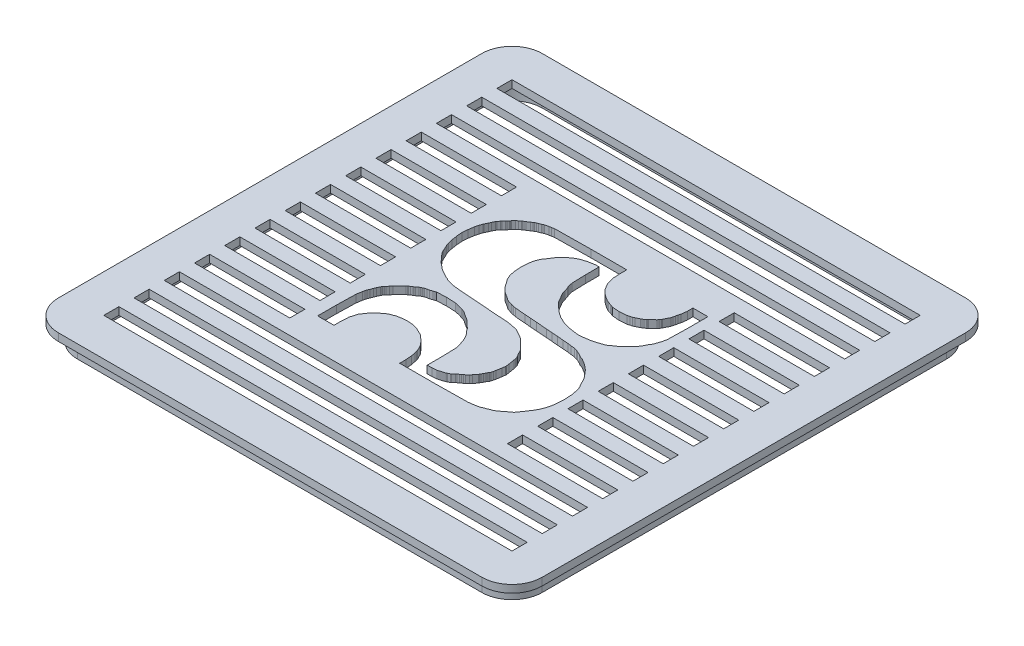
from build123d import *

# Parameters (mm, degrees)
ESQUISSE1_W             = 101.6
ESQUISSE1_H             = 101.6
BOSS_EXTRU_1_DEPTH      = 1.5875
CONG_1_R                = 6.35
BOSS_EXTRU_2_DEPTH      = 3.175
ENL_V_MAT_EXTRU_3_DEPTH = 3.175
ESQUISSE14_W            = 85.725
ESQUISSE14_H            = 3.175
ESQUISSE14_W_2          = 20.0025
ENL_V_MAT_EXTRU_5_DEPTH = 3.175


with BuildPart() as part:
    # Esquisse1 → Boss.-Extru.1 (new body)
    with BuildSketch(Plane(origin=(0, 0, 0), x_dir=(1, 0, 0), z_dir=(0, 1, 0))):
        Rectangle(ESQUISSE1_W, ESQUISSE1_H)
    extrude(amount=BOSS_EXTRU_1_DEPTH)

    # Congé1
    cong_1_edges = [part.edges().sort_by_distance(p)[0] for p in [
        (50.8, 0.79375, 50.8),
        (-50.8, 0.79375, 50.8),
        (-50.8, 0.79375, -50.8),
        (50.8, 0.79375, -50.8),
    ]]
    fillet(cong_1_edges, radius=CONG_1_R)

    # Esquisse2 → Boss.-Extru.2 (add)
    with BuildSketch(Plane.XZ):
        with BuildLine():
            Line((-42.465625, 48.815625), (42.465625, 48.815625))
            ThreePointArc((42.465625, 48.815625), (46.955753061, 46.955753061), (48.815625, 42.465625))
            Line((48.815625, 42.465625), (48.815625, -42.465625))
            ThreePointArc((48.815625, -42.465625), (46.955753061, -46.955753061), (42.465625, -48.815625))
            Line((42.465625, -48.815625), (-42.465625, -48.815625))
            ThreePointArc((-42.465625, -48.815625), (-46.955753061, -46.955753061), (-48.815625, -42.465625))
            Line((-48.815625, -42.465625), (-48.815625, 42.465625))
            ThreePointArc((-48.815625, 42.465625), (-46.955753061, 46.955753061), (-42.465625, 48.815625))
        make_face()
        with BuildLine():
            Line((-39.290625, 45.640625), (39.290625, 45.640625))
            ThreePointArc((39.290625, 45.640625), (43.780753061, 43.780753061), (45.640625, 39.290625))
            Line((45.640625, 39.290625), (45.640625, -39.290625))
            ThreePointArc((45.640625, -39.290625), (43.780753061, -43.780753061), (39.290625, -45.640625))
            Line((39.290625, -45.640625), (-39.290625, -45.640625))
            ThreePointArc((-39.290625, -45.640625), (-43.780753061, -43.780753061), (-45.640625, -39.290625))
            Line((-45.640625, -39.290625), (-45.640625, 39.290625))
            ThreePointArc((-45.640625, 39.290625), (-43.780753061, 43.780753061), (-39.290625, 45.640625))
        make_face(mode=Mode.SUBTRACT)
    extrude(amount=BOSS_EXTRU_2_DEPTH)

    # Esquisse12 → Enlèv. mat.-Extru.3 (cut)
    with BuildSketch(Plane(origin=(0, 1.5875, 0), x_dir=(1, 0, 0), z_dir=(0, 1, 0))):
        Polygon((-20.314766228, -16.53366558), (-20.219584808, -12.56369892), (-20.124403388, -11.94929832), (-20.029221968, -11.33489772), (-19.934040548, -10.95680856), (-19.838851508, -10.57871178), (-19.743670088, -10.38965958), (-19.648488668, -10.20060738), (-19.553307248, -9.9170367), (-19.458125828, -9.63346602), (-19.362944408, -9.3971622), (-19.267762988, -9.16085076), (-19.172581568, -8.97179856), (-19.077400148, -8.78274636), (-18.982218728, -8.59369416), (-18.887029688, -8.40464196), (-18.791848268, -8.26285662), (-18.649079948, -8.12107128), (-18.506304008, -7.97253462), (-18.173149988, -7.55392992), (-17.839995968, -7.13358024), (-16.461553208, -5.75799498), (-16.317017048, -5.66345364), (-16.195257068, -5.56893516), (-15.936276128, -5.37988296), (-15.629700668, -5.19083076), (-15.460346168, -5.0963199), (-15.310757948, -5.00180142), (-14.889219548, -4.63046358), (-14.698849088, -4.52919378), (-14.508486248, -4.4346753), (-14.318123408, -4.34016444), (-14.127760568, -4.24564596), (-13.699417508, -4.15112748), (-13.271082068, -4.05659376), (-12.985522568, -3.96207528), (-12.699963068, -3.8675568), (-12.414403568, -3.77304594), (-12.128844068, -3.6785046), (-10.177522088, -3.58398612), (-8.226200108, -3.6785046), (-7.750270148, -3.77304594), (-7.274332568, -3.8675568), (-6.988773068, -3.96207528), (-6.703213568, -4.05659376), (-6.370067168, -4.15112748), (-6.036913148, -4.24564596), (-5.846550308, -4.34016444), (-5.656179848, -4.4346753), (-5.465817008, -4.52919378), (-5.275454168, -4.67097912), (-5.106099668, -4.81276446), (-4.799524208, -5.00181666), (-4.492948748, -5.19086886), (-4.323594248, -5.28538734), (-4.180825928, -5.37992106), (-4.038049988, -5.47443954), (-3.893727188, -5.56895802), (-2.324685368, -7.05893472), (-2.134322528, -7.27037448), (-1.943952068, -7.57480872), (-1.794386708, -7.74298212), (-1.372848308, -8.18797488), (-1.182485468, -8.49916044), (-0.992115008, -8.8036023), (-0.896933588, -8.9717757), (-0.801752168, -9.1608279), (-0.706570748, -9.3498801), (-0.611389328, -9.58618392), (-0.516207908, -9.82249536), (-0.421026488, -10.10606604), (-0.325845068, -10.3896291), (-0.230656028, -10.67319978), (-0.135474608, -10.95677046), (-0.040293188, -11.33485962), (0.054888232, -11.7129564), (0.150069652, -14.83221864), (0.150115372, -17.95098558), (1.149554572, -17.95098558), (2.149009012, -17.8564671), (2.434568512, -17.76195624), (2.720128012, -17.66743776), (3.053282032, -17.57289642), (3.386436052, -17.47838556), (3.576798892, -17.38386708), (3.767161732, -17.28933336), (3.957524572, -17.19481488), (4.147895032, -17.1002964), (4.297460392, -17.00577792), (4.718998792, -16.58718084), (4.888353292, -16.43864418), (5.194928752, -16.24958436), (5.432893732, -16.06055502), (5.670866332, -15.87150282), (5.936644312, -15.68245062), (6.337166752, -15.30435384), (6.667844272, -14.92626468), (7.193845252, -14.26890252), (7.289026672, -14.07556788), (7.384208092, -13.90739448), (7.574578552, -13.60296024), (7.764941392, -13.2039999), (7.907717332, -12.94129278), (8.050485652, -12.75224058), (8.145667072, -12.56318838), (8.240848492, -12.13783236), (8.336037532, -11.71247634), (8.431218952, -11.1453426), (8.526400372, -10.57820124), (8.621581792, -9.86928216), (8.526400372, -9.16035546), (8.431218952, -8.54595486), (8.336037532, -7.93155426), (8.240848492, -7.5534651), (8.145667072, -7.17536832), (8.050485652, -6.9390645), (7.907717332, -6.70275306), (7.764941392, -6.51370086), (7.669759972, -6.32464866), (7.574578552, -6.13559646), (7.479397132, -5.94654426), (7.384208092, -5.75749206), (7.289026672, -5.56843986), (7.193845252, -5.42234922), (6.627054412, -4.8122463), (6.527529592, -4.71567042), (5.408372572, -3.5834451), (5.194913512, -3.3943929), (4.909354012, -3.20533308), (4.623794512, -3.01628088), (4.317219052, -2.82722868), (4.147864552, -2.73271782), (3.957501712, -2.63819934), (3.767138872, -2.543658), (3.576776032, -2.44914714), (3.386405572, -2.3073618), (3.053259172, -2.16557646), (2.720105152, -2.07105798), (2.339356612, -1.9765395), (1.958608072, -1.88202864), (1.387489072, -1.78751016), (0.816370072, -1.69299168), (-0.563832908, -1.59848082), (-1.944035888, -1.50396234), (-3.229057448, -1.40944386), (-4.514071388, -1.314933), (-5.799085328, -1.22041452), (-7.084106888, -1.12589604), (-8.369120828, -1.03137756), (-9.654142388, -0.93684384), (-10.606009928, -0.84232536), (-11.557877468, -0.7478145), (-11.938618388, -0.65327316), (-12.319366928, -0.55875468), (-12.700115468, -0.46424382), (-13.080856388, -0.36972534), (-13.271226848, -0.27520686), (-13.461589688, -0.13342152), (-13.794743708, 0.00836382), (-14.127897728, 0.15014154), (-14.318260568, 0.29192688), (-14.508623408, 0.38646822), (-14.698993868, 0.4809867), (-14.889379568, 0.57549756), (-15.058734068, 0.6700389), (-15.365301908, 0.8590911), (-15.650861408, 1.0481433), (-15.936420908, 1.2371955), (-16.155274928, 1.4262477), (-16.602728948, 1.80434448), (-17.077995968, 2.18243364), (-17.459407448, 2.6041854), (-18.217726988, 3.41123484), (-18.316070708, 3.5597715), (-18.690014588, 3.9783762), (-18.792015908, 4.1674284), (-18.887197328, 4.3564806), (-18.982378748, 4.5455328), (-19.077560168, 4.734585), (-19.172741588, 4.97089644), (-19.267923008, 5.20720026), (-19.363104428, 5.39625246), (-19.458285848, 5.58530466), (-19.553467268, 5.77435686), (-19.648656308, 5.96340906), (-19.743837728, 6.24698736), (-19.839019148, 6.53055042), (-19.934200568, 6.95590644), (-20.029381988, 7.38126246), (-20.124563408, 7.99566306), (-20.219744828, 8.61006366), (-20.314926248, 9.79160562), (-20.219744828, 10.97314758), (-20.124563408, 11.58754818), (-20.029381988, 12.20194878), (-19.934200568, 12.58003794), (-19.839019148, 12.9581271), (-19.743837728, 13.24169778), (-19.648656308, 13.52526846), (-19.553467268, 13.71431304), (-19.458285848, 13.90335762), (-19.363104428, 14.09240982), (-19.267923008, 14.2814544), (-19.172741588, 14.51775822), (-19.077560168, 14.75406966), (-18.982378748, 14.94311424), (-18.887197328, 15.13215882), (-18.792015908, 15.32121102), (-18.690014588, 15.5102556), (-18.316070708, 15.9288603), (-18.214092248, 16.07739696), (-17.840140748, 16.42787124), (-17.649777908, 16.6445307), (-17.459415068, 16.9017057), (-17.364226028, 17.02261986), (-17.269044608, 17.17115652), (-16.885697648, 17.58976122), (-16.507555148, 17.87332428), (-16.136217308, 18.15689496), (-16.031632808, 18.25140582), (-15.862278308, 18.34591668), (-15.555702848, 18.53496888), (-15.270150968, 18.72401346), (-14.984591468, 18.91305804), (-14.678016008, 19.10210262), (-14.508661508, 19.24388796), (-14.223102008, 19.3856733), (-13.937542508, 19.48018416), (-13.699577528, 19.57469502), (-13.461612548, 19.66920588), (-13.271249708, 19.76372436), (-13.080879248, 19.85823522), (-12.700138328, 19.95274608), (-12.319389788, 20.04725694), (-11.795865308, 20.14177542), (-11.272340828, 20.23630152), (-3.752612408, 20.33082), (3.767176972, 20.33037042), (3.767176972, 18.77055642), (3.862358392, 17.2109253), (3.957539812, 16.88009538), (4.052721232, 16.54926546), (4.147902652, 16.21843554), (4.243091692, 15.88760562), (4.338273112, 15.69856104), (4.433454532, 15.50950884), (4.528635952, 15.34133544), (4.718998792, 15.03689358), (4.909361632, 14.73245934), (5.004543052, 14.56427832), (5.099732092, 14.46300852), (5.432261272, 14.09167068), (5.956402972, 13.61905542), (6.595522852, 13.14644016), (6.908270512, 12.95739558), (7.214845972, 12.76834338), (7.384200472, 12.67383252), (7.574563312, 12.57932166), (7.764926152, 12.4848108), (8.098080172, 12.39029994), (8.431234192, 12.29578908), (8.716793692, 12.20127822), (9.002345572, 12.05949288), (10.572926632, 11.91770754), (12.143500072, 12.05949288), (12.571843132, 12.20127822), (13.000178572, 12.29578908), (13.190549032, 12.39029994), (13.380911872, 12.4848108), (13.571274712, 12.57932166), (13.761637552, 12.67383252), (13.952008012, 12.76834338), (14.142370852, 12.86285424), (14.311725352, 12.9573651), (14.618293192, 13.1464173), (14.877274132, 13.33546188), (14.999041732, 13.42998798), (15.096737752, 13.52449884), (16.046098312, 14.44637406), (16.236461152, 14.65877394), (16.426831612, 14.96320818), (16.522013032, 15.1313892), (16.617194452, 15.32043378), (16.712375872, 15.50947836), (16.807557292, 15.69853056), (16.902738712, 15.88757514), (16.997920132, 16.07661972), (17.093101552, 16.2656643), (17.188282972, 16.64376108), (17.283472012, 17.02185024), (17.378653432, 17.4944655), (17.521421752, 17.96708076), (17.664197692, 19.14862272), (17.664151972, 20.33037042), (19.234786372, 20.33037042), (20.805344572, 20.33037042), (20.805344572, 16.12413042), (20.710163152, 11.91785232), (20.614981732, 11.44523706), (20.519800312, 10.9726218), (20.424618892, 10.68905112), (20.329429852, 10.40548044), (20.234248432, 10.12190976), (20.139067012, 9.8383467), (20.043885592, 9.60203526), (19.901109652, 9.36573144), (19.758341332, 9.17667924), (19.663159912, 8.98762704), (19.567978492, 8.79857484), (19.472789452, 8.60952264), (19.377608032, 8.42046282), (19.282426612, 8.23141062), (19.187245192, 8.08962528), (19.092063772, 7.94784756), (18.996882352, 7.77967416), (18.806519512, 7.4752323), (18.616133812, 7.26325914), (17.517383152, 6.151905), (16.997965852, 5.67928974), (16.385432152, 5.20667448), (16.236468772, 5.112156), (16.046098312, 5.01762228), (15.855735472, 4.91635248), (15.434197072, 4.54500702), (15.284601232, 4.45048854), (14.999049352, 4.35595482), (14.713489852, 4.26143634), (14.427930352, 4.16691786), (14.142370852, 4.07238414), (13.856811352, 3.97786566), (13.571251852, 3.8833548), (13.190503312, 3.78881346), (12.809762392, 3.69429498), (12.191048872, 3.59978412), (11.572335352, 3.50526564), (10.572880912, 3.4107243), (9.573426472, 3.50526564), (9.002307472, 3.59978412), (8.431188472, 3.69429498), (8.002853032, 3.78881346), (7.574509972, 3.8833548), (7.288950472, 3.97786566), (7.003390972, 4.07238414), (6.765425992, 4.16691786), (6.527461012, 4.26143634), (6.337090552, 4.35595482), (6.146727712, 4.45048854), (5.956364872, 4.54500702), (5.765994412, 4.6395255), (5.528029432, 4.73405922), (5.290064452, 4.87584456), (5.120709952, 5.0176299), (4.814142112, 5.2066821), (4.550566312, 5.3957343), (3.767085532, 6.05739414), (3.053457292, 6.7190616), (2.529658492, 7.28189766), (2.434477072, 7.38072144), (2.339295652, 7.54888722), (2.148932812, 7.85332908), (1.958569972, 8.184159), (1.768199512, 8.51498892), (1.577836672, 8.81942316), (1.482655252, 8.98759656), (1.387473832, 9.17664876), (1.292292412, 9.36570096), (1.197110992, 9.69653088), (1.101921952, 10.0273608), (1.006740532, 10.31093148), (0.911559112, 10.59450216), (0.816377692, 10.87807284), (0.673601752, 11.16164352), (0.530833432, 11.68151802), (0.435652012, 12.20139252), (0.340470592, 15.08435094), (0.340462972, 17.96740842), (-0.325906028, 17.96740842), (-0.992214068, 17.87289756), (-1.468144028, 17.77837146), (-1.944073988, 17.6838606), (-2.229633488, 17.58934974), (-2.515192988, 17.49483888), (-2.800752488, 17.4003204), (-3.086311988, 17.30580954), (-3.276674828, 17.21129868), (-3.467045288, 17.11678782), (-3.657408128, 17.02227696), (-3.847770968, 16.92100716), (-4.316903888, 16.54966932), (-4.514086628, 16.45084554), (-5.083384448, 15.88800186), (-6.037073168, 14.9188674), (-6.227436008, 14.65920828), (-6.417798848, 14.30750718), (-6.519777308, 14.09206692), (-6.893728808, 13.67346222), (-6.988910228, 13.52493318), (-7.084091648, 13.33588098), (-7.179273068, 13.1468364), (-7.274454488, 12.95779182), (-7.369635908, 12.76874724), (-7.464817328, 12.48517656), (-7.560006368, 12.20160588), (-7.655187788, 11.77624986), (-7.750369208, 11.35090146), (-7.845550628, 9.79127034), (-7.750369208, 8.23163922), (-7.655187788, 7.8062832), (-7.560006368, 7.38092718), (-7.464817328, 7.05009726), (-7.369635908, 6.71926734), (-7.274454488, 6.53021514), (-7.179273068, 6.34116294), (-7.084091648, 6.15211074), (-6.988910228, 5.96305854), (-6.893728808, 5.81452188), (-6.519777308, 5.39591718), (-6.417798848, 5.20686498), (-6.322617428, 5.01781278), (-6.227436008, 4.89690624), (-6.037073168, 4.63973124), (-5.846710328, 4.37940918), (-5.078987708, 3.59998224), (-4.704472328, 3.31641156), (-4.258953788, 3.03284088), (-3.942975248, 2.84378868), (-3.636407408, 2.65473648), (-3.467052908, 2.51295114), (-3.276690068, 2.3711658), (-3.086319608, 2.27664732), (-2.800760108, 2.18213646), (-2.515200608, 2.08761798), (-2.229641108, 1.9930995), (-1.944081608, 1.89856578), (-1.468151648, 1.8040473), (-0.992221688, 1.70951358), (0.102421792, 1.6149951), (1.197065272, 1.52047662), (2.482086832, 1.42596576), (3.767100772, 1.33144728), (4.956933292, 1.2369288), (6.146765812, 1.14241032), (7.384192852, 1.0478766), (8.621612272, 0.95335812), (9.811444792, 0.85884726), (11.001277312, 0.76432878), (11.762774392, 0.6698103), (12.524263852, 0.57527658), (12.857417872, 0.4807581), (13.190564272, 0.38623962), (13.476123772, 0.29172876), (13.761683272, 0.14994342), (14.047242772, 0.00815808), (14.332802272, -0.13362726), (14.523165112, -0.2754126), (14.713535572, -0.36993108), (14.999095072, -0.46444194), (15.284654572, -0.55898328), (15.454009072, -0.65350176), (15.760576912, -0.84255396), (16.067152372, -1.03160616), (16.236506872, -1.12612464), (16.385470252, -1.2206355), (16.998003952, -1.69325076), (17.562943132, -2.16586602), (17.664296752, -2.26563468), (18.235415752, -2.92205958), (18.806534752, -3.60488016), (18.996897592, -3.8672901), (19.187268052, -4.17172434), (19.282449472, -4.33989774), (19.377630892, -4.555338), (19.567993732, -4.9070391), (19.758356572, -5.30599182), (19.901132512, -5.56869894), (20.043908452, -5.75775114), (20.139089872, -5.94680334), (20.234271292, -6.13585554), (20.329452712, -6.32491536), (20.424634132, -6.75026376), (20.519815552, -7.17561978), (20.614996972, -7.64823504), (20.710178392, -8.1208503), (20.805367432, -9.82226676), (20.710178392, -11.52368322), (20.614996972, -12.04355772), (20.519815552, -12.56343984), (20.424634132, -12.941529), (20.329452712, -13.31961816), (20.234271292, -13.50867036), (20.139089872, -13.69772256), (20.043908452, -14.0285601), (19.901132512, -14.35939002), (19.758356572, -14.54844222), (19.663175152, -14.73749442), (19.567993732, -14.90566782), (19.377630892, -15.21010206), (19.187268052, -15.49367274), (18.996897592, -15.77724342), (18.806534752, -16.0608141), (18.616171912, -16.34437716), (18.425801452, -16.61089428), (18.140241952, -17.00604462), (17.854682452, -17.42205852), (17.658124552, -17.57317836), (16.998003952, -18.04579362), (16.406478592, -18.51840888), (16.141325452, -18.70746108), (15.834749992, -18.89651328), (15.665395492, -19.03829862), (15.475032652, -19.18008396), (15.284662192, -19.27459482), (14.999110312, -19.3691133), (14.713543192, -19.46365464), (14.523180352, -19.5581655), (14.332817512, -19.65268398), (14.047258012, -19.74722532), (13.761698512, -19.84173618), (13.571335672, -19.93625466), (13.380949972, -20.03077314), (12.952606912, -20.12530686), (12.524271472, -20.21982534), (11.857963432, -20.31434382), (11.191663012, -20.40887754), (4.052683132, -20.50339602), (-3.085946228, -20.50292358), (-3.085946228, -19.22733558), (-3.181127648, -17.95127514), (-3.276309068, -17.47865988), (-3.371490488, -17.00604462), (-3.466671908, -16.62794784), (-3.561860948, -16.24985868), (-3.657042368, -16.06080648), (-3.752223788, -15.87175428), (-3.847405208, -15.68270208), (-3.942586628, -15.49364988), (-4.037768048, -15.30459006), (-4.139746508, -15.11553786), (-4.513698008, -14.71780434), (-4.704060848, -14.45387802), (-4.894423688, -14.24147052), (-5.870362808, -13.3195953), (-6.131850728, -13.1305431), (-6.486013088, -12.9414909), (-6.702969728, -12.84697242), (-6.893332568, -12.75245394), (-7.083695408, -12.65792022), (-7.274065868, -12.56340174), (-7.464451568, -12.46888326), (-7.750011068, -12.3743724), (-8.035562948, -12.27985392), (-8.416311488, -12.18533544), (-8.797060028, -12.09082458), (-9.939298028, -11.9963061), (-11.081536028, -12.09082458), (-11.605060508, -12.18533544), (-12.128584988, -12.27985392), (-12.318947828, -12.3743724), (-12.509318288, -12.46888326), (-12.794870168, -12.56340174), (-13.080429668, -12.65792022), (-13.249784168, -12.75245394), (-13.556359628, -12.94150614), (-13.865000108, -13.13055834), (-15.079338548, -14.22293106), (-15.460087088, -14.64293022), (-15.840835628, -15.15539808), (-15.936017048, -15.3046053), (-16.031198468, -15.4936575), (-16.173974408, -15.6827097), (-16.316742728, -15.8717619), (-16.411924148, -16.0608141), (-16.507113188, -16.43891088), (-16.602294608, -16.81700004), (-16.697476028, -17.10057072), (-16.792657448, -17.3841414), (-16.887838868, -18.94377252), (-16.887823628, -20.50292358), (-18.601180628, -20.50292358), (-20.314537628, -20.50292358), align=None)
    extrude(amount=-ENL_V_MAT_EXTRU_3_DEPTH, mode=Mode.SUBTRACT)

    # Esquisse14 → Enlèv. mat.-Extru.5 (cut)
    with BuildSketch(Plane.XZ):
        with Locations((0, 34.925)):
            Rectangle(ESQUISSE14_W, ESQUISSE14_H)
        with Locations((0, 41.275)):
            Rectangle(ESQUISSE14_W, ESQUISSE14_H)
        with Locations((0, 28.575)):
            Rectangle(ESQUISSE14_W, ESQUISSE14_H)
        with Locations((-32.86125, 22.225)):
            Rectangle(ESQUISSE14_W_2, ESQUISSE14_H)
        with Locations((32.86125, 22.225)):
            Rectangle(ESQUISSE14_W_2, ESQUISSE14_H)
        with Locations((-32.86125, 15.875)):
            Rectangle(ESQUISSE14_W_2, ESQUISSE14_H)
        with Locations((32.86125, 15.875)):
            Rectangle(ESQUISSE14_W_2, ESQUISSE14_H)
        with Locations((-32.86125, 9.525)):
            Rectangle(ESQUISSE14_W_2, ESQUISSE14_H)
        with Locations((32.86125, 9.525)):
            Rectangle(ESQUISSE14_W_2, ESQUISSE14_H)
        with Locations((-32.86125, 3.175)):
            Rectangle(ESQUISSE14_W_2, ESQUISSE14_H)
        with Locations((32.86125, 3.175)):
            Rectangle(ESQUISSE14_W_2, ESQUISSE14_H)
        with Locations((-32.86125, -3.175)):
            Rectangle(ESQUISSE14_W_2, ESQUISSE14_H)
        with Locations((32.86125, -3.175)):
            Rectangle(ESQUISSE14_W_2, ESQUISSE14_H)
        with Locations((-32.86125, -9.525)):
            Rectangle(ESQUISSE14_W_2, ESQUISSE14_H)
        with Locations((32.86125, -9.525)):
            Rectangle(ESQUISSE14_W_2, ESQUISSE14_H)
        with Locations((-32.86125, -15.875)):
            Rectangle(ESQUISSE14_W_2, ESQUISSE14_H)
        with Locations((32.86125, -15.875)):
            Rectangle(ESQUISSE14_W_2, ESQUISSE14_H)
        with Locations((-32.86125, -22.225)):
            Rectangle(ESQUISSE14_W_2, ESQUISSE14_H)
        with Locations((32.86125, -22.225)):
            Rectangle(ESQUISSE14_W_2, ESQUISSE14_H)
        with Locations((0, -28.575)):
            Rectangle(ESQUISSE14_W, ESQUISSE14_H)
        with Locations((0, -34.925)):
            Rectangle(ESQUISSE14_W, ESQUISSE14_H)
        with Locations((0, -41.275)):
            Rectangle(ESQUISSE14_W, ESQUISSE14_H)
    extrude(amount=-ENL_V_MAT_EXTRU_5_DEPTH, mode=Mode.SUBTRACT)


solid = part.part
